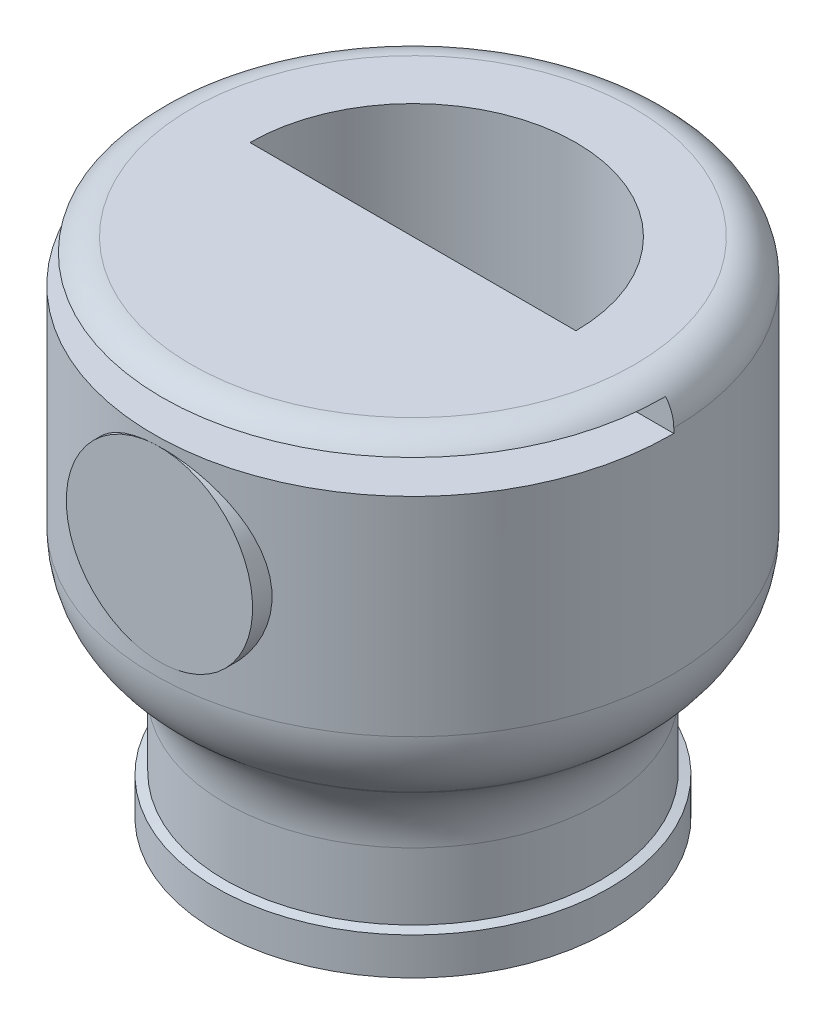
from build123d import *
from build123d.topology import SkipClean

# Parameters (mm, degrees)
SKETCH10_R              = 10
BOSS_EXTRUDE1_DEPTH     = 5
CUT_EXTRUDE3_DEPTH      = 45
CUT_EXTRUDE3_DEPTH_BACK = 20
SKETCH12_W              = 60
SKETCH12_H              = 3
CUT_EXTRUDE4_DEPTH      = 28


with BuildPart() as part:
    # Sketch1 → Revolve1 (revolve)
    with BuildSketch(Plane.XY):
        with BuildLine():
            Line((20.9, 0), (23.871591838, 0))
            Line((23.871591838, 0), (23.871591838, 4))
            Line((23.871591838, 4), (22.9, 4.236662843))
            Line((22.9, 4.236662843), (22.9, 11.404308102))
            ThreePointArc((22.9, 11.404308102), (23.83692213, 15.63049072), (26.472123903, 19.064752533))
            Line((26.472123903, 19.064752533), (26.988320528, 19.497892931))
            ThreePointArc((26.988320528, 19.497892931), (29.623522302, 22.932154745), (30.560444431, 27.158337362))
            Line((30.560444431, 27.158337362), (30.560444431, 50))
            ThreePointArc((30.560444431, 50), (29.388871556, 52.828427125), (26.560444431, 54))
            Line((26.560444431, 54), (2.764914955, 54))
            Line((2.764914955, 54), (2.764914955, 15))
            Line((2.764914955, 15), (19.9, 15))
            ThreePointArc((19.9, 15), (20.607106781, 14.707106781), (20.9, 14))
            Line((20.9, 14), (20.9, 0))
        make_face()
    revolve(axis=Axis((2.764914955, 7.821821657, 0), (0, 1, 0)))

    # Sketch10 → Boss-Extrude1 (add)
    with SkipClean():  # the faces are left unmerged after this step: merging them gives an invalid solid
        with BuildSketch(Plane.XY.offset(27.795529476)):
            with Locations((3.346345887, 38.658337362)):
                Circle(SKETCH10_R)
        extrude(amount=-BOSS_EXTRUDE1_DEPTH)

    # Sketch11 → Cut-Extrude3 (cut, two sides: drawn at the far end of the back side and taken through both)
    with SkipClean():  # the faces are left unmerged after this step: merging them gives an invalid solid
        with BuildSketch(Plane(origin=(0, 17, 0), x_dir=(1, 0, 0), z_dir=(0, 1, 0)).offset(-CUT_EXTRUDE3_DEPTH_BACK)):
            with BuildLine():
                Line((-14.735085045, 0), (20.264914955, 0))
                ThreePointArc((20.264914955, 0), (2.764914955, 17.5), (-14.735085045, 0))
            make_face()
        extrude(amount=CUT_EXTRUDE3_DEPTH + CUT_EXTRUDE3_DEPTH_BACK, mode=Mode.SUBTRACT)

    # Sketch12 → Cut-Extrude4 (cut)
    with SkipClean():  # the faces are left unmerged after this step: merging them gives an invalid solid
        with BuildSketch(Plane.XY.offset(27.795529476)):
            with Locations((3.002856973, 51)):
                Rectangle(SKETCH12_W, SKETCH12_H)
        extrude(amount=-CUT_EXTRUDE4_DEPTH, mode=Mode.SUBTRACT)


solid = part.part
